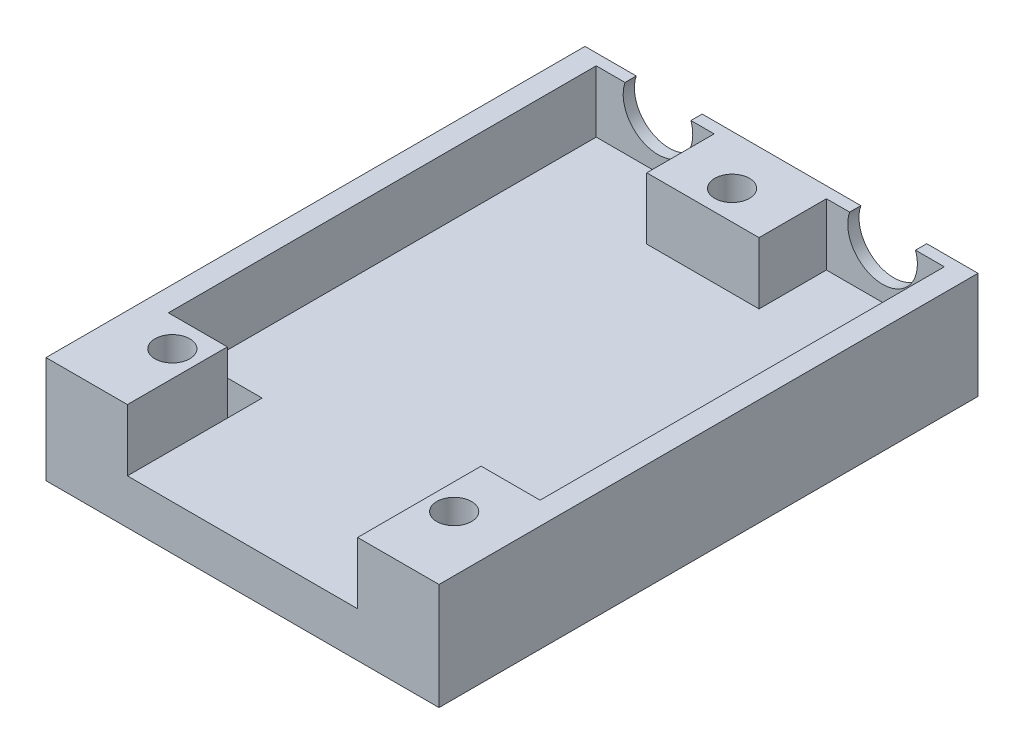
from build123d import *

# Parameters (mm, degrees)
SKETCH1_W           = 35
SKETCH1_H           = 48
BOSS_EXTRUDE1_DEPTH = 4
SKETCH2_W           = 35
SKETCH2_H           = 48
SKETCH2_W_2         = 31
SKETCH2_H_2         = 44
BOSS_EXTRUDE2_DEPTH = 5.5
SKETCH3_W           = 10
SKETCH3_H           = 6
SKETCH3_W_2         = 5.25
SKETCH3_H_2         = 8
BOSS_EXTRUDE3_DEPTH = 5.5
SKETCH4_W           = 20.5
SKETCH4_H           = 5.5
CUT_EXTRUDE1_DEPTH  = 3
CUT_EXTRUDE2_DEPTH  = 2
CUT_EXTRUDE3_REACH  = 33.185
SKETCH7_W           = 5.25
SKETCH7_H           = 3.1
CUT_EXTRUDE4_START  = 9.5
SKETCH8_R           = 1.55
CUT_EXTRUDE4_DEPTH  = 5.5
SKETCH5_W           = 5
SKETCH5_H           = 5
CUT_EXTRUDE5_DEPTH  = 2


with BuildPart() as part:
    # Sketch1 → Boss-Extrude1 (new body)
    with BuildSketch(Plane(origin=(0, 0, 0), x_dir=(1, 0, 0), z_dir=(0, 1, 0))):
        Rectangle(SKETCH1_W, SKETCH1_H)
    extrude(amount=BOSS_EXTRUDE1_DEPTH)

    # Sketch2 → Boss-Extrude2 (add)
    with BuildSketch(Plane(origin=(0, 4, 0), x_dir=(1, 0, 0), z_dir=(0, 1, 0))):
        Rectangle(SKETCH2_W, SKETCH2_H)
        with Locations((0, 1)):
            Rectangle(SKETCH2_W_2, SKETCH2_H_2, mode=Mode.SUBTRACT)
    extrude(amount=BOSS_EXTRUDE2_DEPTH)

    # Sketch3 → Boss-Extrude3 (add)
    with BuildSketch(Plane(origin=(0, 4, 0), x_dir=(1, 0, 0), z_dir=(0, 1, 0))):
        with Locations((0, 20)):
            Rectangle(SKETCH3_W, SKETCH3_H)
        with Locations((-12.875, -17)):
            Rectangle(SKETCH3_W_2, SKETCH3_H_2)
        with Locations((12.875, -17)):
            Rectangle(SKETCH3_W_2, SKETCH3_H_2)
    extrude(amount=BOSS_EXTRUDE3_DEPTH)

    # Sketch4 → Cut-Extrude1 (cut)
    with BuildSketch(Plane.XY.offset(24)):
        with Locations((0, 6.75)):
            Rectangle(SKETCH4_W, SKETCH4_H)
    extrude(amount=-CUT_EXTRUDE1_DEPTH, mode=Mode.SUBTRACT)

    # Sketch6 → Cut-Extrude2 (cut)
    with BuildSketch(Plane(origin=(0, 0, -24), x_dir=(-1, 0, 0), z_dir=(0, 0, -1))):
        with BuildLine():
            ThreePointArc((-12.93428015, 9.5), (-10, 5.4), (-7.06571985, 9.5))
            Line((-7.06571985, 9.5), (-12.93428015, 9.5))
        make_face()
        with BuildLine():
            Line((12.93428015, 9.5), (7.06571985, 9.5))
            ThreePointArc((7.06571985, 9.5), (10, 5.4), (12.93428015, 9.5))
        make_face()
    extrude(amount=-CUT_EXTRUDE2_DEPTH, mode=Mode.SUBTRACT)

    # Cut-Extrude3: up to this face of the body (flat: up to its plane)
    cut_extrude3_end = Plane(part.part.faces().sort_by_distance((0, 0, 0))[0])
    # Sketch7 → Cut-Extrude3 (cut, up to the picked face)
    with BuildSketch(Plane(origin=(0, 9.5, 0), x_dir=(1, 0, 0), z_dir=(0, 1, 0)), mode=Mode.PRIVATE) as cut_extrude3_sk1:
        with Locations((-12.875, -13.55)):
            Rectangle(SKETCH7_W, SKETCH7_H)
    cut_extrude3_tool1 = split(extrude(cut_extrude3_sk1.sketch, amount=-CUT_EXTRUDE3_REACH, mode=Mode.PRIVATE), bisect_by=cut_extrude3_end, keep=Keep.BOTH, mode=Mode.PRIVATE)
    add(cut_extrude3_tool1.solids().sort_by(Axis((-12.875, 9.5, 13.55), (0, -1, 0)))[0], mode=Mode.SUBTRACT)

    # Sketch8 → Cut-Extrude4 (cut)
    with BuildSketch(Plane(origin=(0, 0, 0), x_dir=(1, 0, 0), z_dir=(0, 1, 0)).offset(CUT_EXTRUDE4_START)):
        with Locations(Location((-12.55, -17.7, 0), (0, 0, 270))):
            Circle(SKETCH8_R)
        with Locations(Location((12.55, -17.7, 0), (0, 0, 270))):
            Circle(SKETCH8_R)
        with Locations(Location((0, 19.6, 0), (0, 0, 270))):
            Circle(SKETCH8_R)
    extrude(amount=-CUT_EXTRUDE4_DEPTH, mode=Mode.SUBTRACT)

    # Sketch5 → Cut-Extrude5 (cut)
    with BuildSketch(Plane.XZ):
        with Locations((-0.05, 6.1)):
            Rectangle(SKETCH5_W, SKETCH5_H)
        with Locations((-0.05, -6.1)):
            Rectangle(SKETCH5_W, SKETCH5_H)
    extrude(amount=-CUT_EXTRUDE5_DEPTH, mode=Mode.SUBTRACT)


solid = part.part
